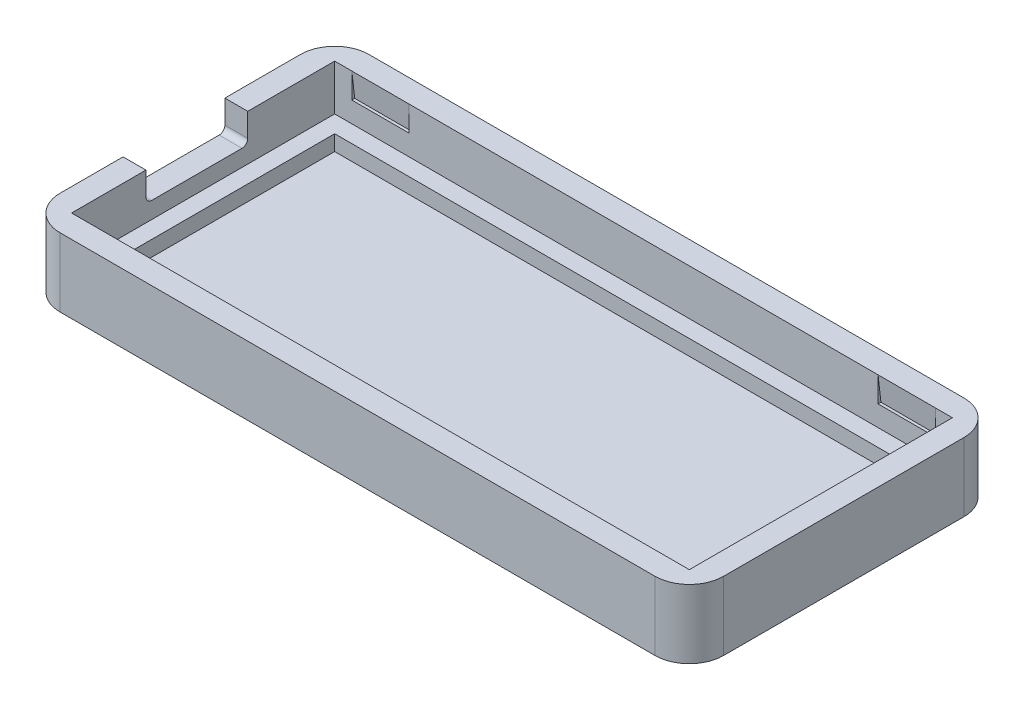
from build123d import *

# Parameters (mm, degrees)
SKETCH1_W           = 58
SKETCH1_H           = 27
BOSS_EXTRUDE1_DEPTH = 6
SKETCH2_W           = 54
SKETCH2_H           = 23
CUT_EXTRUDE1_DEPTH  = 4
SKETCH3_W           = 8.9
SKETCH3_H           = 2.55
CUT_EXTRUDE2_DEPTH  = 58.915887285
FILLET1_R           = 0.5
FILLET2_R           = 3
SKETCH4_W           = 51
SKETCH4_H           = 20
CUT_EXTRUDE3_DEPTH  = 1.35
CUT_EXTRUDE5_DEPTH  = 5


with BuildPart() as part:
    # Sketch1 → Boss-Extrude1 (new body)
    with BuildSketch(Plane(origin=(0, 0, 0), x_dir=(1, 0, 0), z_dir=(0, 1, 0))):
        Rectangle(SKETCH1_W, SKETCH1_H)
    extrude(amount=BOSS_EXTRUDE1_DEPTH)

    # Sketch2 → Cut-Extrude1 (cut)
    with BuildSketch(Plane(origin=(0, 6, 0), x_dir=(1, 0, 0), z_dir=(0, 1, 0))):
        Rectangle(SKETCH2_W, SKETCH2_H)
    extrude(amount=-CUT_EXTRUDE1_DEPTH, mode=Mode.SUBTRACT)

    # Sketch3 → Cut-Extrude2 (cut, through all)
    with BuildSketch(Plane(origin=(-27, 0, 0), x_dir=(0, 0, -1), z_dir=(1, 0, 0))):
        with Locations((-0.55, 4.725)):
            Rectangle(SKETCH3_W, SKETCH3_H)
    extrude(amount=-CUT_EXTRUDE2_DEPTH, mode=Mode.SUBTRACT)

    # Fillet1
    fillet1_edges = [part.edges().sort_by_distance(p)[0] for p in [
        (-28, 3.45, 5),
        (-28, 3.45, -3.9),
    ]]
    fillet(fillet1_edges, radius=FILLET1_R)

    # Fillet2
    fillet2_edges = [part.edges().sort_by_distance(p)[0] for p in [
        (-29, 3, -13.5),
        (29, 3, -13.5),
        (29, 3, 13.5),
        (-29, 3, 13.5),
    ]]
    fillet(fillet2_edges, radius=FILLET2_R)

    # Sketch4 → Cut-Extrude3 (cut)
    with BuildSketch(Plane(origin=(0, 2, 0), x_dir=(1, 0, 0), z_dir=(0, 1, 0))):
        Rectangle(SKETCH4_W, SKETCH4_H)
    extrude(amount=-CUT_EXTRUDE3_DEPTH, mode=Mode.SUBTRACT)

    # Sketch6 → Cut-Extrude5 (cut)
    with BuildSketch(Plane.ZY.offset(-25.5)):
        Polygon((-11.75, 3.8), (-11.5, 3.8), (-11.5, 6), align=None)
        Polygon((11.5, 6), (11.5, 3.8), (11.75, 3.8), align=None)
    cut_extrude5 = extrude(amount=CUT_EXTRUDE5_DEPTH, mode=Mode.SUBTRACT)

    # Mirror1: Cut-Extrude5 across plane
    add(cut_extrude5.mirror(Plane(origin=(0, 0, 0), x_dir=(0, 0, 1), z_dir=(1, 0, 0))), mode=Mode.SUBTRACT)


solid = part.part
